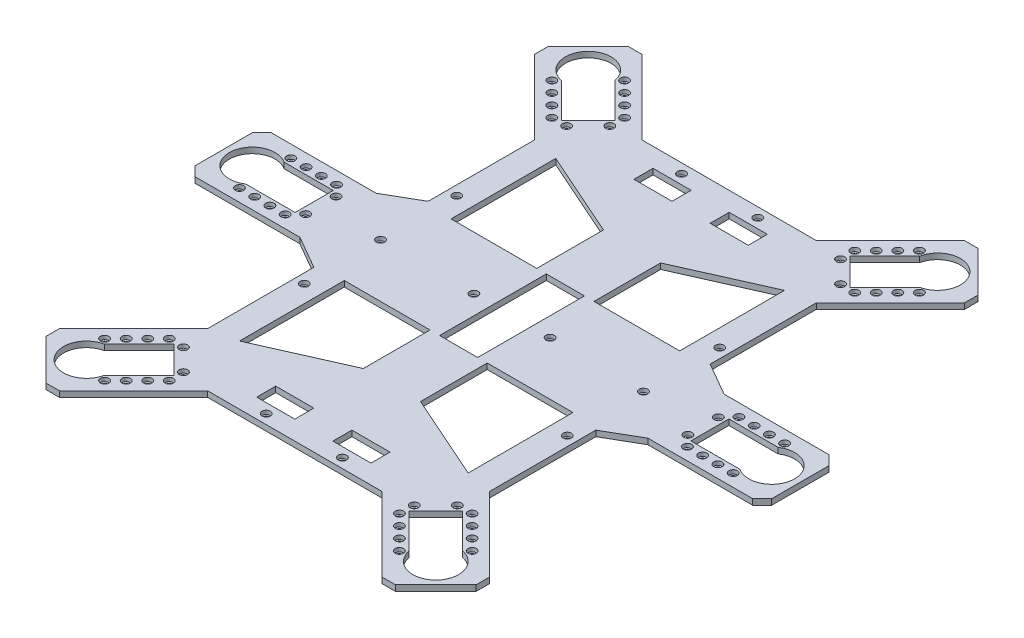
from build123d import *

# Parameters (mm, degrees)
EXTRUDE_1_DEPTH              = 3
CUT_EXTRUDE_1_REACH          = 217.134
HOLE_WIZARD_M2_2_D           = 2.4
HOLE_WIZARD_M2_2_CBORE_D     = 4.4
HOLE_WIZARD_M2_2_CBORE_DEPTH = 2
CUT_EXTRUDE_2_REACH          = 217.134
HOLE_WIZARD_M2_3_D           = 2.4
HOLE_WIZARD_M2_3_CBORE_D     = 4.4
HOLE_WIZARD_M2_3_CBORE_DEPTH = 2
MIRROR_7_COPY_1_REACH        = 217.134
MIRROR_7_COPY_2_D            = 2.4
MIRROR_7_COPY_2_CBORE_D      = 4.4
MIRROR_7_COPY_2_CBORE_DEPTH  = 2
CUT_EXTRUDE_3_REACH          = 217.134
SKETCH_18_W                  = 20
SKETCH_18_H                  = 10
HOLE_WIZARD_M2_4_D           = 2.4
HOLE_WIZARD_M2_4_CBORE_D     = 4.4
HOLE_WIZARD_M2_4_CBORE_DEPTH = 2
HOLE_WIZARD_M2_5_D           = 2.4
HOLE_WIZARD_M2_5_CBORE_D     = 4.4
HOLE_WIZARD_M2_5_CBORE_DEPTH = 2
HOLE_WIZARD_M2_6_D           = 2.4
HOLE_WIZARD_M2_6_CBORE_D     = 4.4
HOLE_WIZARD_M2_6_CBORE_DEPTH = 2
SKETCH_24_W                  = 20
SKETCH_24_H                  = 56
CUT_EXTRUDE_4_DEPTH          = 10
HOLE_WIZARD_M2_7_D           = 2.4
HOLE_WIZARD_M2_7_CBORE_D     = 4.4
HOLE_WIZARD_M2_7_CBORE_DEPTH = 2


with BuildPart() as part:
    # 草图1 → 凸台-拉伸1 (new body)
    with BuildSketch(Plane(origin=(0, 0, 0), x_dir=(1, 0, 0), z_dir=(0, 1, 0))):
        Polygon((-45.715728753, 114), (45.715728753, 114), (84.606601718, 152.890872965), (91.67766953, 152.890872965), (112.890872965, 131.67766953), (112.890872965, 124.606601718), (74, 85.715728753), (74, 30), (91.320508076, 20), (146.320508076, 20), (151.320508076, 15), (151.320508076, -15), (146.320508076, -20), (91.320508076, -20), (74, -30), (74, -85.715728753), (112.890872965, -124.606601718), (112.890872965, -131.67766953), (91.67766953, -152.890872965), (84.606601718, -152.890872965), (45.715728753, -114), (-45.715728753, -114), (-84.606601718, -152.890872965), (-91.67766953, -152.890872965), (-112.890872965, -131.67766953), (-112.890872965, -124.606601718), (-74, -85.715728753), (-74, -30), (-91.320508076, -20), (-146.320508076, -20), (-151.320508076, -15), (-151.320508076, 15), (-146.320508076, 20), (-91.320508076, 20), (-74, 30), (-74, 85.715728753), (-112.890872965, 124.606601718), (-112.890872965, 131.67766953), (-91.67766953, 152.890872965), (-84.606601718, 152.890872965), align=None)
    extrude(amount=EXTRUDE_1_DEPTH)

    # 草图2 → 切除-拉伸1 (cut, up to next)
    with BuildSketch(Plane(origin=(0, 3, 0), x_dir=(1, 0, 0), z_dir=(0, 1, 0)), mode=Mode.PRIVATE) as cut_extrude_1_sk1:
        with BuildLine():
            Line((103.820508076, -10), (103.820508076, 10))
            Line((103.820508076, 10), (129.687258495, 10))
            ThreePointArc((129.687258495, 10), (148.320508076, 0), (129.687258495, -10))
            Line((129.687258495, -10), (103.820508076, -10))
        make_face()
    cut_extrude_1_tool1 = extrude(cut_extrude_1_sk1.sketch, amount=-CUT_EXTRUDE_1_REACH, mode=Mode.PRIVATE) & part.part
    cut_extrude_1 = cut_extrude_1_tool1.solids().sort_by_distance((125.74589, 3, 0))[0]
    add(cut_extrude_1, mode=Mode.SUBTRACT)

    # M2 凹头盖螺钉的柱形沉头孔2 (through all)
    with Locations(Plane(origin=(100.320508076, 3, -8), x_dir=(0, 0, 1), z_dir=(0, 1, 0))):
        with Locations((0, 0), (-5.5, 5.25), (-5.5, 13.25), (-5.5, 21.25), (-5.5, 29.25), (16, 0), (21.5, 5.25), (21.5, 13.25), (21.5, 21.25), (21.5, 29.25)):
            hole_wizard_m2_2 = CounterBoreHole(HOLE_WIZARD_M2_2_D / 2, HOLE_WIZARD_M2_2_CBORE_D / 2, HOLE_WIZARD_M2_2_CBORE_DEPTH)

    # 草图10 → 切除-拉伸2 (cut, up to next)
    with BuildSketch(Plane(origin=(0, 3, 0), x_dir=(1, 0, 0), z_dir=(0, 1, 0)), mode=Mode.PRIVATE) as cut_extrude_2_sk1:
        with BuildLine():
            Line((75.767766953, 101.625631329), (61.625631329, 115.767766953))
            Line((61.625631329, 115.767766953), (79.916185958, 134.058321582))
            ThreePointArc((79.916185958, 134.058321582), (100.162950904, 140.162950904), (94.058321582, 119.916185958))
            Line((94.058321582, 119.916185958), (75.767766953, 101.625631329))
        make_face()
    cut_extrude_2_tool1 = extrude(cut_extrude_2_sk1.sketch, amount=-CUT_EXTRUDE_2_REACH, mode=Mode.PRIVATE) & part.part
    cut_extrude_2 = cut_extrude_2_tool1.solids().sort_by_distance((84.200285, 3, -124.200285))[0]
    add(cut_extrude_2, mode=Mode.SUBTRACT)

    # M2 凹头盖螺钉的柱形沉头孔3 (through all)
    with Locations(Plane(origin=(60.388194462, 3, -119.480077554), x_dir=(0, 0, 1), z_dir=(0, 1, 0))):
        with Locations((0, 0), (-5.65685425, 5.65685425), (-11.313708499, 11.313708499), (-16.970562749, 16.970562749), (7.601397898, 0.176776695), (18.915106397, 11.490485194), (19.091883092, 19.091883092), (13.435028842, 24.748737342), (7.778174593, 30.405591591), (2.121320343, 36.062445841)):
            hole_wizard_m2_3 = CounterBoreHole(HOLE_WIZARD_M2_3_D / 2, HOLE_WIZARD_M2_3_CBORE_D / 2, HOLE_WIZARD_M2_3_CBORE_DEPTH)

    # 镜向5: 切除-拉伸1, M2 凹头盖螺钉的柱形沉头孔2 across plane
    add(cut_extrude_1.mirror(Plane(origin=(0, 0, 0), x_dir=(0, 0, 1), z_dir=(1, 0, 0))), mode=Mode.SUBTRACT)
    add(hole_wizard_m2_2.mirror(Plane(origin=(0, 0, 0), x_dir=(0, 0, 1), z_dir=(1, 0, 0))), mode=Mode.SUBTRACT)

    # 镜向6: 切除-拉伸2, M2 凹头盖螺钉的柱形沉头孔3 across plane
    add(cut_extrude_2.mirror(Plane(origin=(0, 0, 0), x_dir=(0, 0, 1), z_dir=(1, 0, 0))), mode=Mode.SUBTRACT)
    add(hole_wizard_m2_3.mirror(Plane(origin=(0, 0, 0), x_dir=(0, 0, 1), z_dir=(1, 0, 0))), mode=Mode.SUBTRACT)

    # 镜向7: 切除-拉伸2, M2 凹头盖螺钉的柱形沉头孔3 across plane
    add(cut_extrude_2.mirror(Plane.XY), mode=Mode.SUBTRACT)
    add(hole_wizard_m2_3.mirror(Plane.XY), mode=Mode.SUBTRACT)

    # 镜向7 copy 1 sketch → 镜向7 copy 1 (cut, up to next)
    with BuildSketch(Plane(origin=(0, 3, 0), x_dir=(-1, 0, 0), z_dir=(0, 1, 0)), mode=Mode.PRIVATE) as mirror_7_copy_1_sk1:
        with BuildLine():
            Line((75.767766953, 101.625631329), (61.625631329, 115.767766953))
            Line((61.625631329, 115.767766953), (79.916185958, 134.058321582))
            ThreePointArc((79.916185958, 134.058321582), (100.162950904, 140.162950904), (94.058321582, 119.916185958))
            Line((94.058321582, 119.916185958), (75.767766953, 101.625631329))
        make_face()
    mirror_7_copy_1_tool1 = extrude(mirror_7_copy_1_sk1.sketch, amount=-MIRROR_7_COPY_1_REACH, mode=Mode.PRIVATE) & part.part
    add(mirror_7_copy_1_tool1.solids().sort_by_distance((-84.200285, 3, 124.200285))[0], mode=Mode.SUBTRACT)

    # 镜向7 copy 2 (through all)
    with Locations(Plane(origin=(-60.388194462, 3, 119.480077554), x_dir=(0, 0, -1), z_dir=(0, 1, 0))):
        with Locations((0, 0), (-5.65685425, 5.65685425), (-11.313708499, 11.313708499), (-16.970562749, 16.970562749), (7.601397898, 0.176776695), (18.915106397, 11.490485194), (19.091883092, 19.091883092), (13.435028842, 24.748737342), (7.778174593, 30.405591591), (2.121320343, 36.062445841)):
            CounterBoreHole(MIRROR_7_COPY_2_D / 2, MIRROR_7_COPY_2_CBORE_D / 2, MIRROR_7_COPY_2_CBORE_DEPTH)

    # 草图18 → 切除-拉伸3 (cut, up to next)
    with BuildSketch(Plane(origin=(0, 3, 0), x_dir=(1, 0, 0), z_dir=(0, 1, 0)), mode=Mode.PRIVATE) as cut_extrude_3_sk1:
        Polygon((-60, -28), (-15, -28), (-15, -63), (-60, -83), align=None)
    cut_extrude_3_tool1 = extrude(cut_extrude_3_sk1.sketch, amount=-CUT_EXTRUDE_3_REACH, mode=Mode.PRIVATE) & part.part
    # 草图18 → 切除-拉伸3 (cut, up to next)
    with BuildSketch(Plane(origin=(0, 3, 0), x_dir=(1, 0, 0), z_dir=(0, 1, 0)), mode=Mode.PRIVATE) as cut_extrude_3_sk2:
        with Locations((20, -99)):
            Rectangle(SKETCH_18_W, SKETCH_18_H)
    cut_extrude_3_tool2 = extrude(cut_extrude_3_sk2.sketch, amount=-CUT_EXTRUDE_3_REACH, mode=Mode.PRIVATE) & part.part
    # 草图18 → 切除-拉伸3 (cut, up to next)
    with BuildSketch(Plane(origin=(0, 3, 0), x_dir=(1, 0, 0), z_dir=(0, 1, 0)), mode=Mode.PRIVATE) as cut_extrude_3_sk3:
        with Locations((-20, -99)):
            Rectangle(SKETCH_18_W, SKETCH_18_H)
    cut_extrude_3_tool3 = extrude(cut_extrude_3_sk3.sketch, amount=-CUT_EXTRUDE_3_REACH, mode=Mode.PRIVATE) & part.part
    # 草图18 → 切除-拉伸3 (cut, up to next)
    with BuildSketch(Plane(origin=(0, 3, 0), x_dir=(1, 0, 0), z_dir=(0, 1, 0)), mode=Mode.PRIVATE) as cut_extrude_3_sk4:
        Polygon((15, -63), (60, -83), (60, -28), (15, -28), align=None)
    cut_extrude_3_tool4 = extrude(cut_extrude_3_sk4.sketch, amount=-CUT_EXTRUDE_3_REACH, mode=Mode.PRIVATE) & part.part
    # 草图18 → 切除-拉伸3 (cut, up to next)
    with BuildSketch(Plane(origin=(0, 3, 0), x_dir=(1, 0, 0), z_dir=(0, 1, 0)), mode=Mode.PRIVATE) as cut_extrude_3_sk5:
        with Locations((-20, 99)):
            Rectangle(SKETCH_18_W, SKETCH_18_H)
    cut_extrude_3_tool5 = extrude(cut_extrude_3_sk5.sketch, amount=-CUT_EXTRUDE_3_REACH, mode=Mode.PRIVATE) & part.part
    # 草图18 → 切除-拉伸3 (cut, up to next)
    with BuildSketch(Plane(origin=(0, 3, 0), x_dir=(1, 0, 0), z_dir=(0, 1, 0)), mode=Mode.PRIVATE) as cut_extrude_3_sk6:
        with Locations((20, 99)):
            Rectangle(SKETCH_18_W, SKETCH_18_H)
    cut_extrude_3_tool6 = extrude(cut_extrude_3_sk6.sketch, amount=-CUT_EXTRUDE_3_REACH, mode=Mode.PRIVATE) & part.part
    # 草图18 → 切除-拉伸3 (cut, up to next)
    with BuildSketch(Plane(origin=(0, 3, 0), x_dir=(1, 0, 0), z_dir=(0, 1, 0)), mode=Mode.PRIVATE) as cut_extrude_3_sk7:
        Polygon((15, 63), (60, 83), (60, 28), (15, 28), align=None)
    cut_extrude_3_tool7 = extrude(cut_extrude_3_sk7.sketch, amount=-CUT_EXTRUDE_3_REACH, mode=Mode.PRIVATE) & part.part
    # 草图18 → 切除-拉伸3 (cut, up to next)
    with BuildSketch(Plane(origin=(0, 3, 0), x_dir=(1, 0, 0), z_dir=(0, 1, 0)), mode=Mode.PRIVATE) as cut_extrude_3_sk8:
        Polygon((-15, 28), (-15, 63), (-60, 83), (-60, 28), align=None)
    cut_extrude_3_tool8 = extrude(cut_extrude_3_sk8.sketch, amount=-CUT_EXTRUDE_3_REACH, mode=Mode.PRIVATE) & part.part
    add(cut_extrude_3_tool1.solids().sort_by_distance((-39.166667, 3, 50.87037))[0], mode=Mode.SUBTRACT)
    add(cut_extrude_3_tool2.solids().sort_by_distance((20, 3, 99))[0], mode=Mode.SUBTRACT)
    add(cut_extrude_3_tool3.solids().sort_by_distance((-20, 3, 99))[0], mode=Mode.SUBTRACT)
    add(cut_extrude_3_tool4.solids().sort_by_distance((39.166667, 3, 50.87037))[0], mode=Mode.SUBTRACT)
    add(cut_extrude_3_tool5.solids().sort_by_distance((-20, 3, -99))[0], mode=Mode.SUBTRACT)
    add(cut_extrude_3_tool6.solids().sort_by_distance((20, 3, -99))[0], mode=Mode.SUBTRACT)
    add(cut_extrude_3_tool7.solids().sort_by_distance((39.166667, 3, -50.87037))[0], mode=Mode.SUBTRACT)
    add(cut_extrude_3_tool8.solids().sort_by_distance((-39.166667, 3, -50.87037))[0], mode=Mode.SUBTRACT)

    # M2 凹头盖螺钉的柱形沉头孔4 (through all)
    with Locations(Plane(origin=(-20, 3, 109), x_dir=(0, 0, 1), z_dir=(0, 1, 0))):
        with Locations((0, 0), (0, 40), (-218, 0), (-218, 40)):
            CounterBoreHole(HOLE_WIZARD_M2_4_D / 2, HOLE_WIZARD_M2_4_CBORE_D / 2, HOLE_WIZARD_M2_4_CBORE_DEPTH)

    # M2 凹头盖螺钉的柱形沉头孔5 (through all)
    with Locations(Plane(origin=(-69, 3, -40), x_dir=(0, 0, 1), z_dir=(0, 1, 0))):
        with Locations((0, 0), (0, 138)):
            hole_wizard_m2_5 = CounterBoreHole(HOLE_WIZARD_M2_5_D / 2, HOLE_WIZARD_M2_5_CBORE_D / 2, HOLE_WIZARD_M2_5_CBORE_DEPTH)

    # 镜向8: M2 凹头盖螺钉的柱形沉头孔5 across plane
    add(hole_wizard_m2_5.mirror(Plane.XY), mode=Mode.SUBTRACT)

    # M2 凹头盖螺钉的柱形沉头孔6 (through all)
    with Locations(Plane(origin=(-69, 3, 0), x_dir=(0, 0, 1), z_dir=(0, 1, 0))):
        with Locations((0, 0), (0, 138)):
            CounterBoreHole(HOLE_WIZARD_M2_6_D / 2, HOLE_WIZARD_M2_6_CBORE_D / 2, HOLE_WIZARD_M2_6_CBORE_DEPTH)

    # 草图24 → 切除-拉伸4 (cut)
    with BuildSketch(Plane(origin=(0, 3, 0), x_dir=(1, 0, 0), z_dir=(0, 1, 0))):
        Rectangle(SKETCH_24_W, SKETCH_24_H)
    extrude(amount=-CUT_EXTRUDE_4_DEPTH, mode=Mode.SUBTRACT)

    # M2 凹头盖螺钉的柱形沉头孔7 (through all)
    with Locations(Plane(origin=(-20, 3, 0), x_dir=(0, 0, 1), z_dir=(0, 1, 0))):
        with Locations((0, 0), (0, 40)):
            CounterBoreHole(HOLE_WIZARD_M2_7_D / 2, HOLE_WIZARD_M2_7_CBORE_D / 2, HOLE_WIZARD_M2_7_CBORE_DEPTH)


solid = part.part
